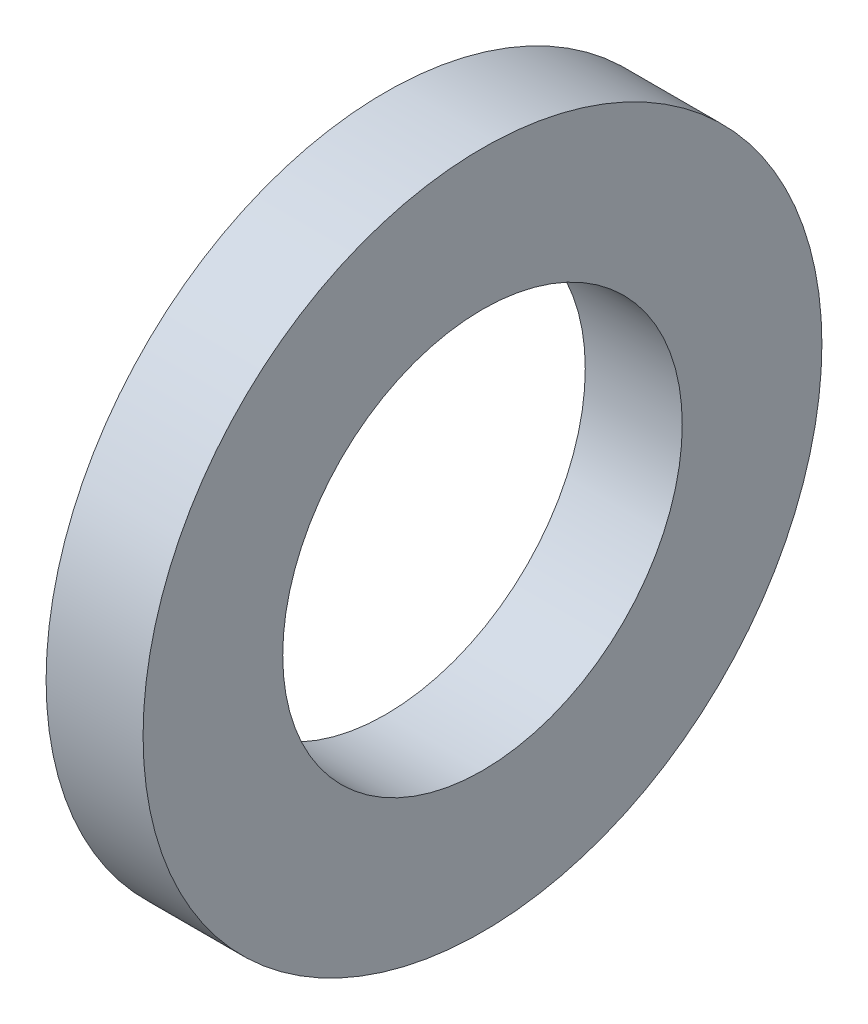
from build123d import *

# Parameters (mm, degrees)
SKETCH1_R           = 11.1125
SKETCH1_R_2         = 6.5405
BOSS_EXTRUDE1_DEPTH = 3.175


with BuildPart() as part:
    # Sketch1 → Boss-Extrude1 (new body)
    with BuildSketch(Plane(origin=(0, 0, 0), x_dir=(0, 0, -1), z_dir=(1, 0, 0))):
        Circle(SKETCH1_R)
        Circle(SKETCH1_R_2, mode=Mode.SUBTRACT)
    extrude(amount=BOSS_EXTRUDE1_DEPTH)


solid = part.part
